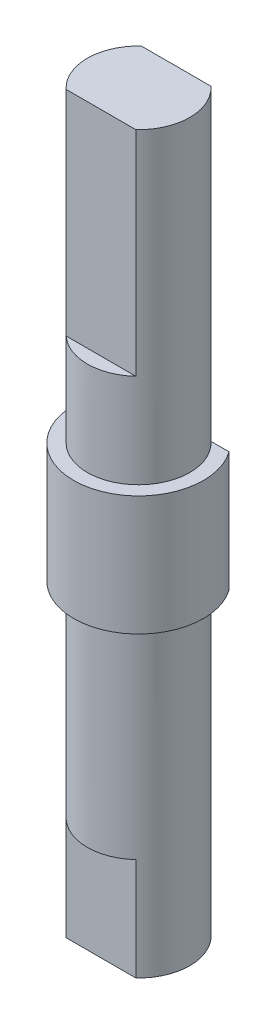
from build123d import *

# Parameters (mm, degrees)
SKETCH1_R               = 1.9
BOSS_EXTRUDE1_DEPTH     = 1.75
SKETCH2_R               = 1.5
BOSS_EXTRUDE2_DEPTH     = 9
BOSS_EXTRUDE3_START     = 9
SKETCH4_R               = 1.5
BOSS_EXTRUDE3_DEPTH     = 9
CUT_EXTRUDE1_DEPTH      = 12.08072651
CUT_EXTRUDE1_DEPTH_BACK = 12.08072651
CUT_EXTRUDE2_DEPTH      = 6.25
CUT_EXTRUDE3_START      = -3
CUT_EXTRUDE3_DEPTH      = 3


with BuildPart() as part:
    # Sketch1 → Boss-Extrude1 (new, symmetric)
    with BuildSketch(Plane(origin=(0, 0, 0), x_dir=(1, 0, 0), z_dir=(0, 1, 0))):
        with Locations(Location((0, 0, 0), (0, 0, 270))):
            Circle(SKETCH1_R)
    extrude(amount=BOSS_EXTRUDE1_DEPTH, both=True)

    # Sketch2 → Boss-Extrude2 (add)
    with BuildSketch(Plane.XZ.offset(1.75)):
        with Locations(Location((0, 0, 0), (0, 0, 270))):
            Circle(SKETCH2_R)
    extrude(amount=BOSS_EXTRUDE2_DEPTH)

    # Sketch4 → Boss-Extrude3 (add)
    with BuildSketch(Plane(origin=(0, 1.75, 0), x_dir=(1, 0, 0), z_dir=(0, 1, 0)).offset(BOSS_EXTRUDE3_START)):
        with Locations(Location((0, 0, 0), (0, 0, 90))):
            Circle(SKETCH4_R)
    extrude(amount=-BOSS_EXTRUDE3_DEPTH)

    # Sketch3 → Cut-Extrude1 (cut, two sides: drawn at the far end of the back side and taken through both)
    with BuildSketch(Plane(origin=(0, 0, 0), x_dir=(1, 0, 0), z_dir=(0, 1, 0)).offset(-CUT_EXTRUDE1_DEPTH_BACK)):
        with BuildLine():
            Line((-1.549193338, 1.1), (1.549193338, 1.1))
            ThreePointArc((1.549193338, 1.1), (0, 1.9), (-1.549193338, 1.1))
        make_face()
    extrude(amount=CUT_EXTRUDE1_DEPTH + CUT_EXTRUDE1_DEPTH_BACK, mode=Mode.SUBTRACT)

    # Sketch5 → Cut-Extrude2 (cut)
    with BuildSketch(Plane(origin=(0, 10.75, 0), x_dir=(1, 0, 0), z_dir=(0, 1, 0))):
        with BuildLine():
            Line((1.019803903, -1.1), (-1.019803903, -1.1))
            ThreePointArc((-1.019803903, -1.1), (0, -1.5), (1.019803903, -1.1))
        make_face()
    extrude(amount=-CUT_EXTRUDE2_DEPTH, mode=Mode.SUBTRACT)

    # Sketch6 → Cut-Extrude3 (cut)
    with BuildSketch(Plane.XZ.offset(10.75).offset(CUT_EXTRUDE3_START)):
        with BuildLine():
            Line((-1.019803903, 1.1), (1.019803903, 1.1))
            ThreePointArc((1.019803903, 1.1), (0, 1.5), (-1.019803903, 1.1))
        make_face()
    extrude(amount=CUT_EXTRUDE3_DEPTH, mode=Mode.SUBTRACT)


solid = part.part
